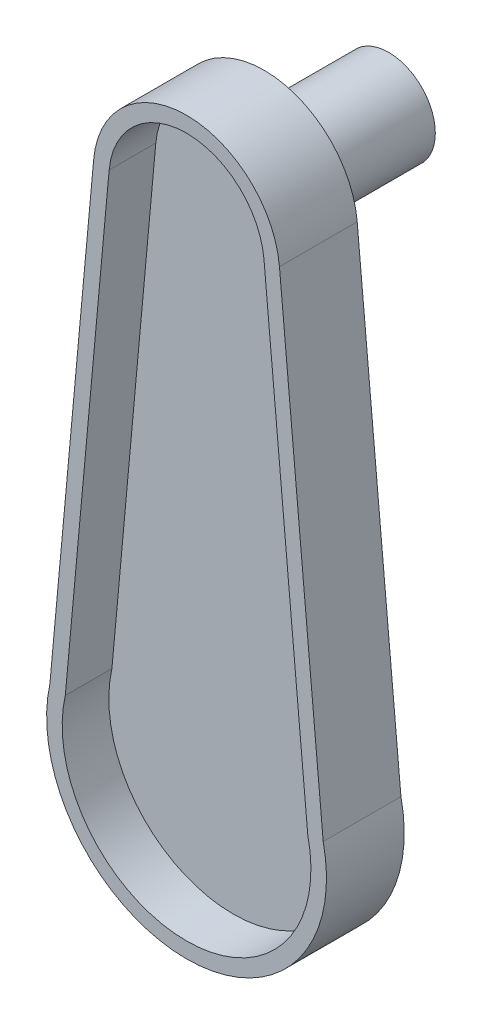
from build123d import *

# Parameters (mm, degrees)
BOSS_EXTRUDE1_DEPTH = 1
EXTRUDE_THIN1_DEPTH = 2.5
SKETCH2_R           = 1.5
BOSS_EXTRUDE2_DEPTH = 4


with BuildPart() as part:
    # Sketch1 → Boss-Extrude1 (new body)
    with BuildSketch(Plane.XY):
        with BuildLine():
            Line((-3.9, 0.888819442), (-2.48949833, 16.228906238))
            ThreePointArc((-2.48949833, 16.228906238), (0, 18.5), (2.48949833, 16.228906238))
            Line((2.48949833, 16.228906238), (3.9, 0.888819442))
            ThreePointArc((3.9, 0.888819442), (0, -4), (-3.9, 0.888819442))
        make_face()
    extrude(amount=BOSS_EXTRUDE1_DEPTH)

    # Sketch1<3> → Extrude-Thin1 (add)
    with BuildSketch(Plane.XY):
        with BuildLine():
            Line((-4.394954578, 0.966630363), (-2.987397996, 16.274687485))
            ThreePointArc((-2.987397996, 16.274687485), (0, 19), (2.987397996, 16.274687485))
            Line((2.987397996, 16.274687485), (4.394954578, 0.966630363))
            ThreePointArc((4.394954578, 0.966630363), (0, -4.5), (-4.394954578, 0.966630363))
        make_face()
        with BuildLine():
            Line((-3.9, 0.888819442), (-2.48949833, 16.228906238))
            ThreePointArc((-2.48949833, 16.228906238), (0, 18.5), (2.48949833, 16.228906238))
            Line((2.48949833, 16.228906238), (3.9, 0.888819442))
            ThreePointArc((3.9, 0.888819442), (0, -4), (-3.9, 0.888819442))
        make_face(mode=Mode.SUBTRACT)
    extrude(amount=EXTRUDE_THIN1_DEPTH)

    # Sketch2 → Boss-Extrude2 (add)
    with BuildSketch(Plane(origin=(0, 0, 0), x_dir=(-1, 0, 0), z_dir=(0, 0, -1))):
        with Locations((0, 16)):
            Circle(SKETCH2_R)
    extrude(amount=BOSS_EXTRUDE2_DEPTH)


solid = part.part
